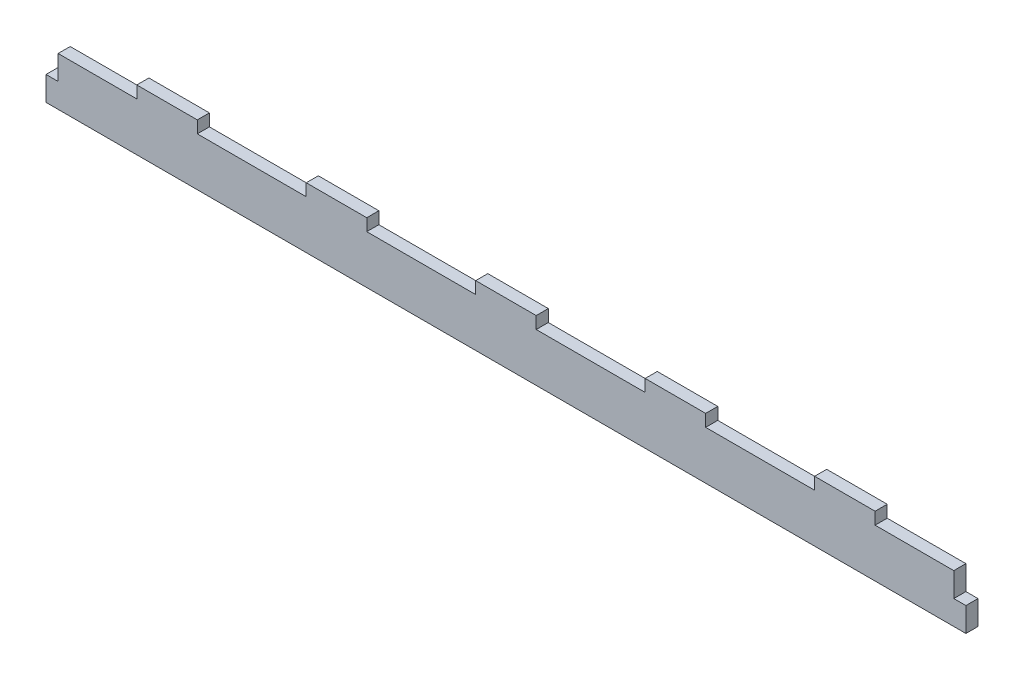
from build123d import *

# Parameters (mm, degrees)
BOSS_EXTRUDE1_DEPTH = 2.5


with BuildPart() as part:
    # Sketch1 → Boss-Extrude1 (new, symmetric)
    with BuildSketch(Plane.XY):
        Polygon((410, -35), (410, -25), (377.5, -25), (377.5, -20), (352.5, -20), (352.5, -25), (307.5, -25), (307.5, -20), (282.5, -20), (282.5, -25), (237.5, -25), (237.5, -20), (212.5, -20), (212.5, -25), (167.5, -25), (167.5, -20), (142.5, -20), (142.5, -25), (97.5, -25), (97.5, -20), (72.5, -20), (72.5, -25), (40, -25), (40, -35), (35, -35), (35, -45), (40, -45), (410, -45), (415, -45), (415, -35), align=None)
    extrude(amount=BOSS_EXTRUDE1_DEPTH, both=True)


solid = part.part
